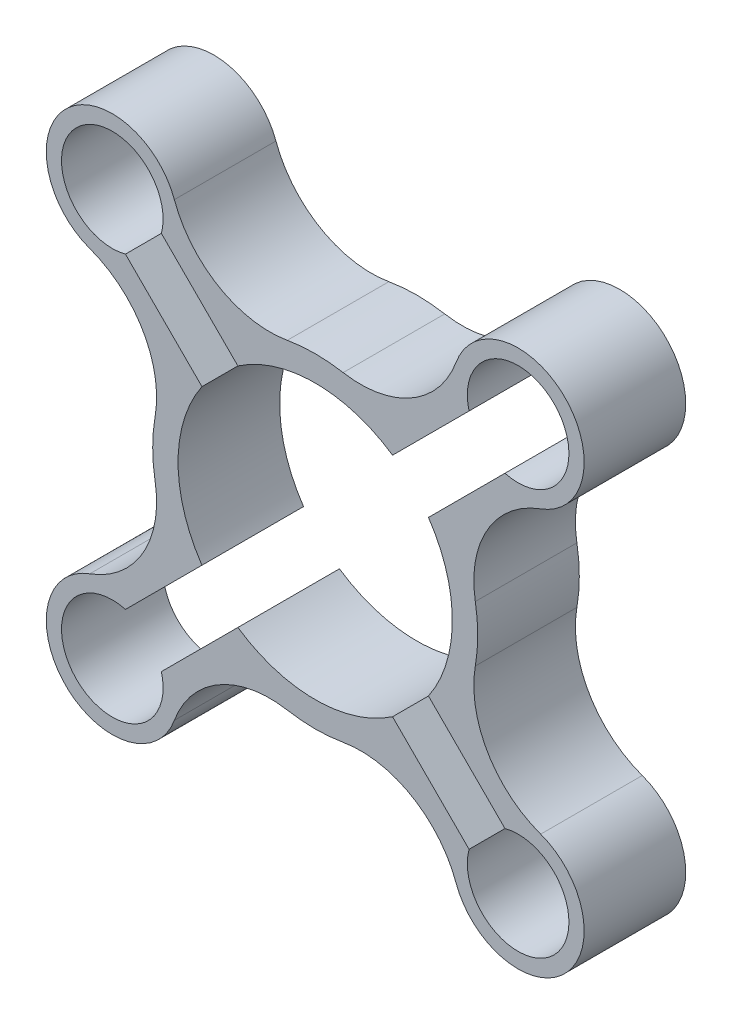
from build123d import *

# Parameters (mm, degrees)
BOSS_EXTRUDE1_DEPTH = 10


with BuildPart() as part:
    # Sketch1 → Boss-Extrude1 (new, symmetric)
    with BuildSketch(Plane.XY):
        with BuildLine():
            ThreePointArc((5.499886369, 31.523820357), (0, 32), (-5.499886369, 31.523820357))
            ThreePointArc((-5.499886369, 31.523820357), (-18.956279365, 33.916662735), (-27.733810979, 44.393071751))
            ThreePointArc((-27.733810979, 44.393071751), (-49.143921292, 49.143921292), (-44.393071751, 27.733810979))
            ThreePointArc((-44.393071751, 27.733810979), (-33.916662735, 18.956279365), (-31.523820357, 5.499886369))
            ThreePointArc((-31.523820357, 5.499886369), (-32, 0), (-31.523820357, -5.499886369))
            ThreePointArc((-31.523820357, -5.499886369), (-33.916662735, -18.956279365), (-44.393071751, -27.733810979))
            ThreePointArc((-44.393071751, -27.733810979), (-49.143921292, -49.143921292), (-27.733810979, -44.393071751))
            ThreePointArc((-27.733810979, -44.393071751), (-18.956279365, -33.916662735), (-5.499886369, -31.523820357))
            ThreePointArc((-5.499886369, -31.523820357), (0, -32), (5.499886369, -31.523820357))
            ThreePointArc((5.499886369, -31.523820357), (18.956279365, -33.916662735), (27.733810979, -44.393071751))
            ThreePointArc((27.733810979, -44.393071751), (49.143921292, -49.143921292), (44.393071751, -27.733810979))
            ThreePointArc((44.393071751, -27.733810979), (33.916662735, -18.956279365), (31.523820357, -5.499886369))
            ThreePointArc((31.523820357, -5.499886369), (32, 0), (31.523820357, 5.499886369))
            ThreePointArc((31.523820357, 5.499886369), (33.916662735, 18.956279365), (44.393071751, 27.733810979))
            ThreePointArc((44.393071751, 27.733810979), (49.143921292, 49.143921292), (27.733810979, 44.393071751))
            ThreePointArc((27.733810979, 44.393071751), (18.956279365, 33.916662735), (5.499886369, 31.523820357))
        make_face()
        with BuildLine():
            Line((37.363342686, 30.292274874), (22.297196945, 15.226129133))
            ThreePointArc((22.297196945, 15.226129133), (27, 0), (22.297196945, -15.226129133))
            Line((22.297196945, -15.226129133), (37.363342686, -30.292274874))
            ThreePointArc((37.363342686, -30.292274874), (47.022600949, -47.022600949), (30.292274874, -37.363342686))
            Line((30.292274874, -37.363342686), (15.226129133, -22.297196945))
            ThreePointArc((15.226129133, -22.297196945), (0, -27), (-15.226129133, -22.297196945))
            Line((-15.226129133, -22.297196945), (-30.292274874, -37.363342686))
            ThreePointArc((-30.292274874, -37.363342686), (-47.022600949, -47.022600949), (-37.363342686, -30.292274874))
            Line((-37.363342686, -30.292274874), (-22.297196945, -15.226129133))
            ThreePointArc((-22.297196945, -15.226129133), (-27, 0), (-22.297196945, 15.226129133))
            Line((-22.297196945, 15.226129133), (-37.363342686, 30.292274874))
            ThreePointArc((-37.363342686, 30.292274874), (-47.022600949, 47.022600949), (-30.292274874, 37.363342686))
            Line((-30.292274874, 37.363342686), (-15.226129133, 22.297196945))
            ThreePointArc((-15.226129133, 22.297196945), (0, 27), (15.226129133, 22.297196945))
            Line((15.226129133, 22.297196945), (30.292274874, 37.363342686))
            ThreePointArc((30.292274874, 37.363342686), (47.022600949, 47.022600949), (37.363342686, 30.292274874))
        make_face(mode=Mode.SUBTRACT)
    extrude(amount=BOSS_EXTRUDE1_DEPTH, both=True)


solid = part.part
